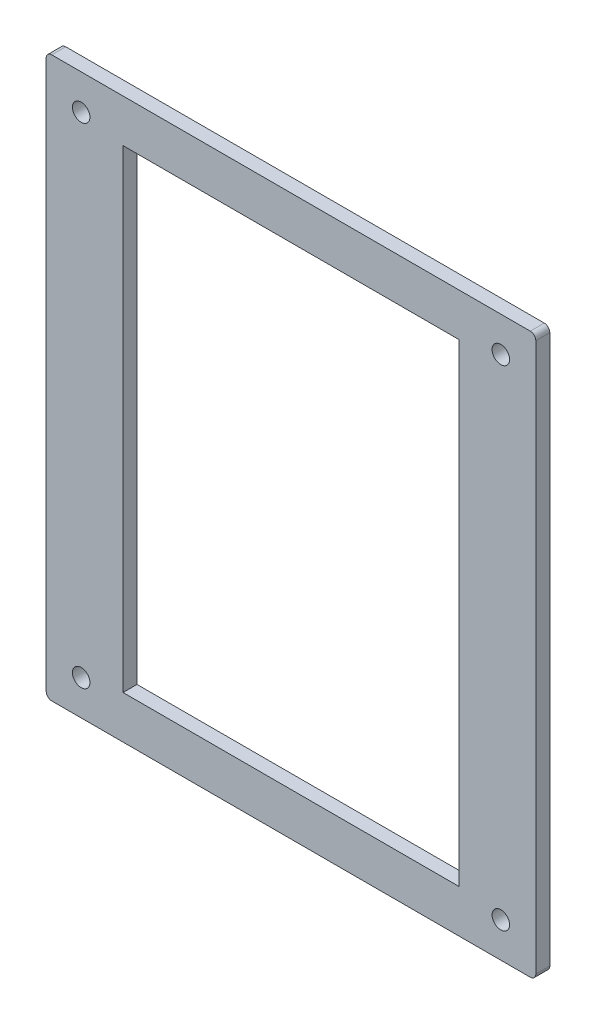
from build123d import *

# Parameters (mm, degrees)
SKETCH1_W           = 88.9
SKETCH1_H           = 101.6
SKETCH1_R           = 1.59
SKETCH1_W_2         = 61
SKETCH1_H_2         = 86
BOSS_EXTRUDE1_DEPTH = 2.54
FILLET1_R           = 1


with BuildPart() as part:
    # Sketch1 → Boss-Extrude1 (new body)
    with BuildSketch(Plane.XY):
        with Locations((44.45, -50.8)):
            Rectangle(SKETCH1_W, SKETCH1_H)
        with Locations((6.35, -6.35)):
            Circle(SKETCH1_R, mode=Mode.SUBTRACT)
        with Locations((82.55, -6.35)):
            Circle(SKETCH1_R, mode=Mode.SUBTRACT)
        with Locations((6.35, -95.25)):
            Circle(SKETCH1_R, mode=Mode.SUBTRACT)
        with Locations((82.55, -95.25)):
            Circle(SKETCH1_R, mode=Mode.SUBTRACT)
        with Locations((44.45, -50.8)):
            Rectangle(SKETCH1_W_2, SKETCH1_H_2, mode=Mode.SUBTRACT)
    extrude(amount=BOSS_EXTRUDE1_DEPTH)

    # Fillet1
    fillet1_edges = [part.edges().sort_by_distance(p)[0] for p in [
        (0, 0, 1.27),
        (88.9, 0, 1.27),
        (88.9, -101.6, 1.27),
        (0, -101.6, 1.27),
    ]]
    fillet(fillet1_edges, radius=FILLET1_R)


solid = part.part
